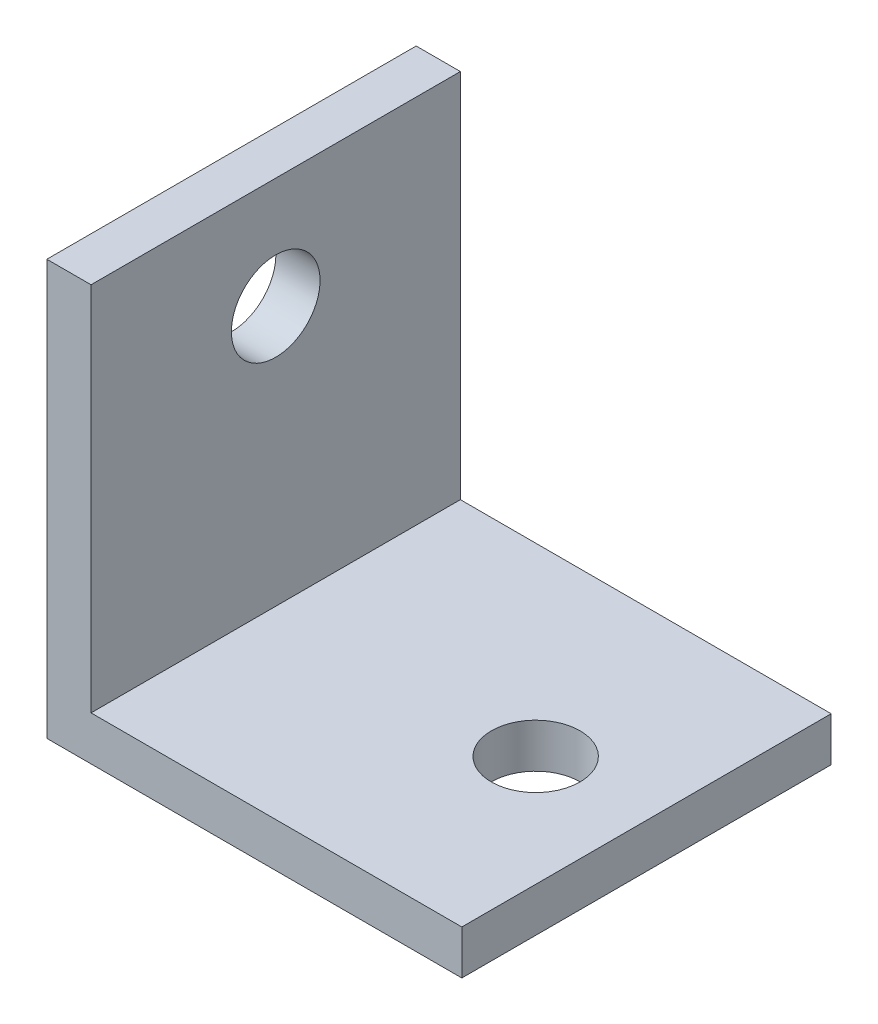
from build123d import *

# Parameters (mm, degrees)
BOSS_EXTRU_1_DEPTH      = 12.7
ESQUISSE2_R             = 1.525
ENL_V_MAT_EXTRU_1_DEPTH = 12.7
ESQUISSE3_R             = 1.525
ENL_V_MAT_EXTRU_2_DEPTH = 12.7


with BuildPart() as part:
    # Esquisse1 → Boss.-Extru.1 (new body)
    with BuildSketch(Plane.XY):
        Polygon((0, 0), (14.27, 0), (14.27, 1.52), (1.52, 1.52), (1.52, 14.27), (0, 14.27), align=None)
    extrude(amount=BOSS_EXTRU_1_DEPTH)

    # Esquisse2 → Enlèv. mat.-Extru.1 (cut)
    with BuildSketch(Plane(origin=(1.52, 0, 0), x_dir=(0, 0, -1), z_dir=(1, 0, 0))):
        with Locations(Location((-6.35, 10.46, 0), (0, 0, 90))):
            Circle(ESQUISSE2_R)
    extrude(amount=-ENL_V_MAT_EXTRU_1_DEPTH, mode=Mode.SUBTRACT)

    # Esquisse3 → Enlèv. mat.-Extru.2 (cut)
    with BuildSketch(Plane(origin=(0, 1.52, 0), x_dir=(1, 0, 0), z_dir=(0, 1, 0))):
        with Locations(Location((10.46, -6.35, 0), (0, 0, 180))):
            Circle(ESQUISSE3_R)
    extrude(amount=-ENL_V_MAT_EXTRU_2_DEPTH, mode=Mode.SUBTRACT)


solid = part.part
